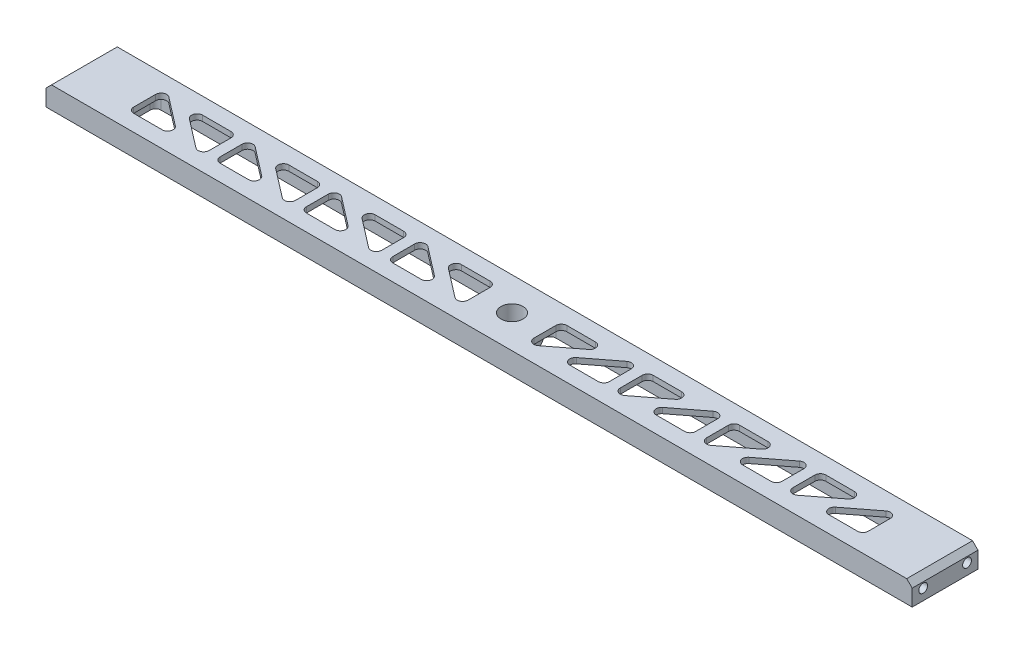
from build123d import *

# Parameters (mm, degrees)
SKETCH1_W                        = 38.1
SKETCH1_H                        = 12.7
BOSS_EXTRUDE1_DEPTH              = 250.825
SKETCH2_R                        = 6.35
CUT_EXTRUDE1_DEPTH               = 252.867769127
F_1_4_20_TAPPED_HOLE1_AT_2_COUNT = 2
F_1_4_20_TAPPED_HOLE1_AT_2_PITCH = 25.4
CHAMFER1_SIZE                    = 3.175
CUT_EXTRUDE2_DEPTH               = 9.525
CUT_EXTRUDE3_DEPTH               = 252.727647965


with BuildPart() as part:
    # Sketch1 → Boss-Extrude1 (new, symmetric)
    with BuildSketch(Plane(origin=(0, 0, 0), x_dir=(0, 0, -1), z_dir=(1, 0, 0))):
        Rectangle(SKETCH1_W, SKETCH1_H)
    extrude(amount=BOSS_EXTRUDE1_DEPTH, both=True)

    # Sketch2 → Cut-Extrude1 (cut, through all)
    with BuildSketch(Plane(origin=(0, 6.35, 0), x_dir=(1, 0, 0), z_dir=(0, 1, 0))):
        with Locations(Location((0, 0, 0), (0, 0, 270))):
            Circle(SKETCH2_R)
    extrude(amount=-CUT_EXTRUDE1_DEPTH, mode=Mode.SUBTRACT)

    # Sketch3 → 1/4-20 Tapped Hole1 (revolve, cut)
    with BuildSketch(Plane(origin=(250.825, 0, 12.7), x_dir=(0, 0, -1), z_dir=(0, 1, 0))):
        Polygon((0, 0), (0, 30.743816902), (2.5527, 29.21), (2.5527, 0), align=None)
    f_1_4_20_tapped_hole1 = revolve(axis=Axis((257.175, 0, 12.7), (-1, 0, 0)), mode=Mode.SUBTRACT)

    # 1/4-20 Tapped Hole1 at 2: 1/4-20 Tapped Hole1 ×2
    with Locations(*[(0, 0, -i * F_1_4_20_TAPPED_HOLE1_AT_2_PITCH) for i in range(1, F_1_4_20_TAPPED_HOLE1_AT_2_COUNT)]):
        add(f_1_4_20_tapped_hole1, mode=Mode.SUBTRACT)

    # Chamfer1
    chamfer1_edges = [part.edges().sort_by_distance(p)[0] for p in [
        (-250.825, 6.35, 0),
        (250.825, 6.35, 0),
    ]]
    chamfer(chamfer1_edges, length=CHAMFER1_SIZE)

    # Sketch4 → Cut-Extrude2 (cut)
    with BuildSketch(Plane.XZ.offset(6.35)):
        with BuildLine():
            Line((-215.9, -12.7), (-12.7, -12.7))
            ThreePointArc((-12.7, -12.7), (-9.860193669, -10.944903166), (-10.16, -7.62))
            ThreePointArc((-10.16, -7.62), (-12.7, 0), (-10.16, 7.62))
            ThreePointArc((-10.16, 7.62), (-9.860193669, 10.944903166), (-12.7, 12.7))
            Line((-12.7, 12.7), (-215.9, 12.7))
            ThreePointArc((-215.9, 12.7), (-218.14506403, 11.77006403), (-219.075, 9.525))
            Line((-219.075, 9.525), (-219.075, -9.525))
            ThreePointArc((-219.075, -9.525), (-218.14506403, -11.77006403), (-215.9, -12.7))
        make_face()
        with BuildLine():
            Line((219.075, -9.525), (219.075, 9.525))
            ThreePointArc((219.075, 9.525), (218.14506403, 11.77006403), (215.9, 12.7))
            Line((215.9, 12.7), (12.7, 12.7))
            ThreePointArc((12.7, 12.7), (9.860193669, 10.944903166), (10.16, 7.62))
            ThreePointArc((10.16, 7.62), (12.7, 0), (10.16, -7.62))
            ThreePointArc((10.16, -7.62), (9.860193669, -10.944903166), (12.7, -12.7))
            Line((12.7, -12.7), (215.9, -12.7))
            ThreePointArc((215.9, -12.7), (218.14506403, -11.77006403), (219.075, -9.525))
        make_face()
    extrude(amount=-CUT_EXTRUDE2_DEPTH, mode=Mode.SUBTRACT)

    # Sketch5 → Cut-Extrude3 (cut, through all)
    with BuildSketch(Plane.XZ.offset(-3.175)):
        with BuildLine():
            Line((-212.725, 6.35), (-212.725, -6.35))
            ThreePointArc((-212.725, -6.35), (-210.951786793, -9.198792514), (-207.612799189, -8.865527383))
            Line((-207.612799189, -8.865527383), (-191.121376316, 3.834472617))
            ThreePointArc((-191.121376316, 3.834472617), (-190.052963676, 7.373187558), (-193.058577128, 9.525))
            Line((-193.058577128, 9.525), (-209.55, 9.525))
            ThreePointArc((-209.55, 9.525), (-211.79506403, 8.59506403), (-212.725, 6.35))
        make_face()
        with BuildLine():
            Line((-190.672373684, -3.834472617), (-174.180950811, 8.865527383))
            ThreePointArc((-174.180950811, 8.865527383), (-170.841963207, 9.198792514), (-169.06875, 6.35))
            Line((-169.06875, 6.35), (-169.06875, -6.35))
            ThreePointArc((-169.06875, -6.35), (-169.99868597, -8.59506403), (-172.24375, -9.525))
            Line((-172.24375, -9.525), (-188.735172872, -9.525))
            ThreePointArc((-188.735172872, -9.525), (-191.740786324, -7.373187558), (-190.672373684, -3.834472617))
        make_face()
        with BuildLine():
            Line((-119.0625, 6.35), (-119.0625, -6.35))
            ThreePointArc((-119.0625, -6.35), (-119.99243597, -8.59506403), (-122.2375, -9.525))
            Line((-122.2375, -9.525), (-138.728922872, -9.525))
            ThreePointArc((-138.728922872, -9.525), (-141.734536324, -7.373187558), (-140.666123684, -3.834472617))
            Line((-140.666123684, -3.834472617), (-124.174700811, 8.865527383))
            ThreePointArc((-124.174700811, 8.865527383), (-120.835713207, 9.198792514), (-119.0625, 6.35))
        make_face()
        with BuildLine():
            Line((-143.052327128, 9.525), (-159.54375, 9.525))
            ThreePointArc((-159.54375, 9.525), (-161.78881403, 8.59506403), (-162.71875, 6.35))
            Line((-162.71875, 6.35), (-162.71875, -6.35))
            ThreePointArc((-162.71875, -6.35), (-160.945536793, -9.198792514), (-157.606549189, -8.865527383))
            Line((-157.606549189, -8.865527383), (-141.115126316, 3.834472617))
            ThreePointArc((-141.115126316, 3.834472617), (-140.046713676, 7.373187558), (-143.052327128, 9.525))
        make_face()
        with BuildLine():
            Line((-69.05625, 6.35), (-69.05625, -6.35))
            ThreePointArc((-69.05625, -6.35), (-69.98618597, -8.59506403), (-72.23125, -9.525))
            Line((-72.23125, -9.525), (-88.722672872, -9.525))
            ThreePointArc((-88.722672872, -9.525), (-91.728286324, -7.373187558), (-90.659873684, -3.834472617))
            Line((-90.659873684, -3.834472617), (-74.168450811, 8.865527383))
            ThreePointArc((-74.168450811, 8.865527383), (-70.829463207, 9.198792514), (-69.05625, 6.35))
        make_face()
        with BuildLine():
            Line((-93.046077128, 9.525), (-109.5375, 9.525))
            ThreePointArc((-109.5375, 9.525), (-111.78256403, 8.59506403), (-112.7125, 6.35))
            Line((-112.7125, 6.35), (-112.7125, -6.35))
            ThreePointArc((-112.7125, -6.35), (-110.939286793, -9.198792514), (-107.600299189, -8.865527383))
            Line((-107.600299189, -8.865527383), (-91.108876316, 3.834472617))
            ThreePointArc((-91.108876316, 3.834472617), (-90.040463676, 7.373187558), (-93.046077128, 9.525))
        make_face()
        with BuildLine():
            Line((-19.05, 6.35), (-19.05, -6.35))
            ThreePointArc((-19.05, -6.35), (-19.97993597, -8.59506403), (-22.225, -9.525))
            Line((-22.225, -9.525), (-38.716422872, -9.525))
            ThreePointArc((-38.716422872, -9.525), (-41.722036324, -7.373187558), (-40.653623684, -3.834472617))
            Line((-40.653623684, -3.834472617), (-24.162200811, 8.865527383))
            ThreePointArc((-24.162200811, 8.865527383), (-20.823213207, 9.198792514), (-19.05, 6.35))
        make_face()
        with BuildLine():
            Line((-43.039827128, 9.525), (-59.53125, 9.525))
            ThreePointArc((-59.53125, 9.525), (-61.77631403, 8.59506403), (-62.70625, 6.35))
            Line((-62.70625, 6.35), (-62.70625, -6.35))
            ThreePointArc((-62.70625, -6.35), (-60.933036793, -9.198792514), (-57.594049189, -8.865527383))
            Line((-57.594049189, -8.865527383), (-41.102626316, 3.834472617))
            ThreePointArc((-41.102626316, 3.834472617), (-40.034213676, 7.373187558), (-43.039827128, 9.525))
        make_face()
    cut_extrude3 = extrude(amount=-CUT_EXTRUDE3_DEPTH, mode=Mode.SUBTRACT)

    # Mirror1: 1/4-20 Tapped Hole1, Cut-Extrude3 across plane
    add(f_1_4_20_tapped_hole1.mirror(Plane(origin=(0, 0, 0), x_dir=(0, 0, 1), z_dir=(1, 0, 0))), mode=Mode.SUBTRACT)
    add(cut_extrude3.mirror(Plane(origin=(0, 0, 0), x_dir=(0, 0, 1), z_dir=(1, 0, 0))), mode=Mode.SUBTRACT)

    # Mirror1 copy 1 sketch → Mirror1 copy 1 (revolve, cut)
    with BuildSketch(Plane(origin=(-250.825, 0, -12.7), x_dir=(0, 0, -1), z_dir=(0, 1, 0))):
        Polygon((0, 0), (0, -30.743816902), (2.5527, -29.21), (2.5527, 0), align=None)
    revolve(axis=Axis((-257.175, 0, -12.7), (-1, 0, 0)), mode=Mode.SUBTRACT)


solid = part.part
